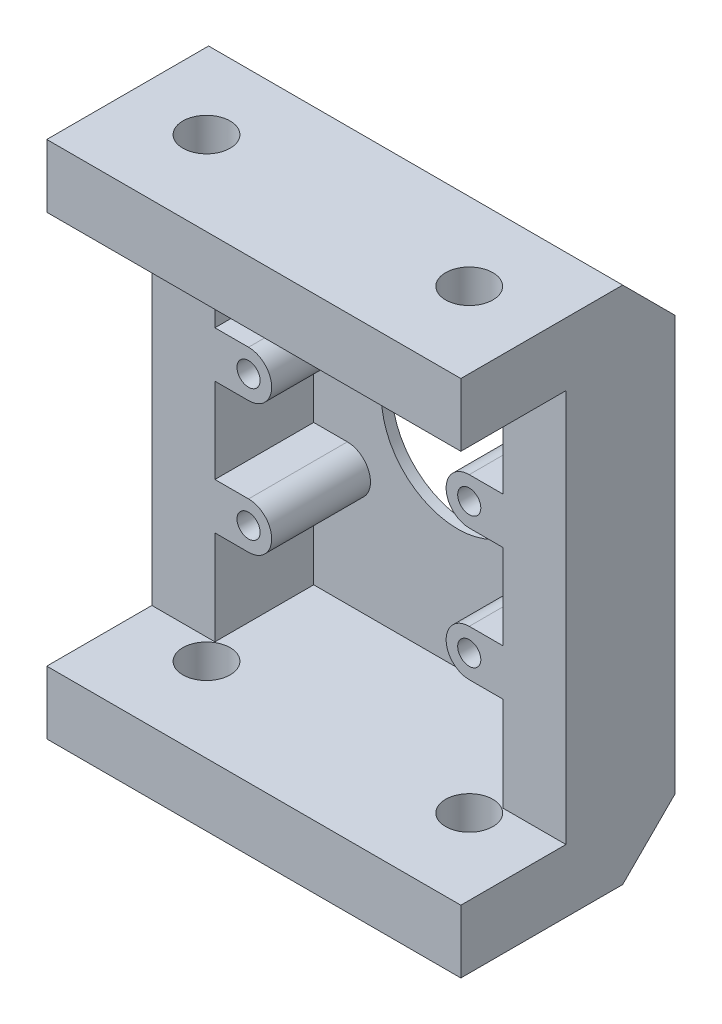
from build123d import *

# Parameters (mm, degrees)
SKETCH1_W                    = 39.4
SKETCH1_H                    = 49.4
BOSS_EXTRUDE1_DEPTH          = 1
SKETCH2_R                    = 7.25
CUT_EXTRUDE1_DEPTH           = 32.609808604
BOSS_EXTRUDE2_START          = -1
SKETCH3_R                    = 2.2
SKETCH3_R_2                  = 1
BOSS_EXTRUDE2_DEPTH          = 10.4
SKETCH4_W                    = 39.4
SKETCH4_H                    = 49.4
SKETCH4_W_2                  = 27.4
SKETCH4_H_2                  = 37.4
BOSS_EXTRUDE4_DEPTH          = 9.4
SKETCH5_W                    = 39.4
SKETCH5_H                    = 6
BOSS_EXTRUDE5_DEPTH          = 10
SKETCH6_R                    = 1.65
CUT_EXTRUDE3_DEPTH           = 57.961478211
SKETCH7_R                    = 2.25
CUT_EXTRUDE4_DEPTH           = 57.961478211
BOSS_EXTRUDE6_START          = -9.4
BOSS_EXTRUDE6_DEPTH          = 9.4
SKETCH9_R                    = 1.1
CUT_EXTRUDE5_DEPTH           = 8
CUT_EXTRUDE5_DRAFT           = -2
CUT_EXTRUDE5_PROFILE_2_DEPTH = 8
CUT_EXTRUDE5_PROFILE_2_DRAFT = -2
CUT_EXTRUDE5_PROFILE_3_DEPTH = 8
CUT_EXTRUDE5_PROFILE_3_DRAFT = -2
CUT_EXTRUDE5_PROFILE_4_DEPTH = 8
CUT_EXTRUDE5_PROFILE_4_DRAFT = -2
CHAMFER1_SIZE                = 5


with BuildPart() as part:
    # Sketch1 → Boss-Extrude1 (new body)
    with BuildSketch(Plane.XY):
        Rectangle(SKETCH1_W, SKETCH1_H)
    extrude(amount=BOSS_EXTRUDE1_DEPTH)

    # Sketch2 → Cut-Extrude1 (cut, through all)
    with BuildSketch(Plane.XY.offset(1)):
        Circle(SKETCH2_R)
    extrude(amount=-CUT_EXTRUDE1_DEPTH, mode=Mode.SUBTRACT)

    # Sketch3 → Boss-Extrude2 (add)
    # profile 1 of 4: a face of its own
    with BuildSketch(Plane.XY.offset(1).offset(BOSS_EXTRUDE2_START)):
        with Locations(Location((-10.5, 4.98, 0), (0, 0, 180))):
            Circle(SKETCH3_R)
        with Locations(Location((-10.5, 4.98, 0), (0, 0, 180))):
            Circle(SKETCH3_R_2, mode=Mode.SUBTRACT)
    # profile 2 of 4: a face of its own
    with BuildSketch(Plane.XY.offset(1).offset(BOSS_EXTRUDE2_START)):
        with Locations(Location((-10.5, -7.52, 0), (0, 0, 180))):
            Circle(SKETCH3_R)
        with Locations(Location((-10.5, -7.52, 0), (0, 0, 180))):
            Circle(SKETCH3_R_2, mode=Mode.SUBTRACT)
    # profile 3 of 4: a face of its own
    with BuildSketch(Plane.XY.offset(1).offset(BOSS_EXTRUDE2_START)):
        with Locations(Location((10.5, -7.52, 0), (0, 0, 180))):
            Circle(SKETCH3_R)
        with Locations(Location((10.5, -7.52, 0), (0, 0, 180))):
            Circle(SKETCH3_R_2, mode=Mode.SUBTRACT)
    # profile 4 of 4: a face of its own
    with BuildSketch(Plane.XY.offset(1).offset(BOSS_EXTRUDE2_START)):
        with Locations(Location((10.5, 4.98, 0), (0, 0, 180))):
            Circle(SKETCH3_R)
        with Locations(Location((10.5, 4.98, 0), (0, 0, 180))):
            Circle(SKETCH3_R_2, mode=Mode.SUBTRACT)
    extrude(amount=BOSS_EXTRUDE2_DEPTH)

    # Sketch4 → Boss-Extrude4 (add)
    with BuildSketch(Plane.XY.offset(1)):
        Rectangle(SKETCH4_W, SKETCH4_H)
        Rectangle(SKETCH4_W_2, SKETCH4_H_2, mode=Mode.SUBTRACT)
    extrude(amount=BOSS_EXTRUDE4_DEPTH)

    # Sketch5 → Boss-Extrude5 (add)
    with BuildSketch(Plane.XY.offset(10.4)):
        with Locations((0, 21.7)):
            Rectangle(SKETCH5_W, SKETCH5_H)
        with Locations((0, -21.7)):
            Rectangle(SKETCH5_W, SKETCH5_H)
    extrude(amount=BOSS_EXTRUDE5_DEPTH)

    # Sketch6 → Cut-Extrude3 (cut, through all)
    with BuildSketch(Plane(origin=(0, 24.7, 0), x_dir=(1, 0, 0), z_dir=(0, 1, 0))):
        with Locations(Location((-12.5, -12.4, 0), (0, 0, 180))):
            Circle(SKETCH6_R)
        with Locations(Location((12.5, -12.4, 0), (0, 0, 180))):
            Circle(SKETCH6_R)
    extrude(amount=-CUT_EXTRUDE3_DEPTH, mode=Mode.SUBTRACT)

    # Sketch7 → Cut-Extrude4 (cut, through all)
    with BuildSketch(Plane(origin=(0, 24.7, 0), x_dir=(1, 0, 0), z_dir=(0, 1, 0))):
        with Locations(Location((12.5, -12.4, 0), (0, 0, 180))):
            Circle(SKETCH7_R)
        with Locations(Location((-12.5, -12.4, 0), (0, 0, 180))):
            Circle(SKETCH7_R)
    extrude(amount=-CUT_EXTRUDE4_DEPTH, mode=Mode.SUBTRACT)

    # Sketch8 → Boss-Extrude6 (add)
    with BuildSketch(Plane.XY.offset(10.4).offset(BOSS_EXTRUDE6_START)):
        with BuildLine():
            Line((-10.5, 7.18), (-13.7, 7.18))
            Line((-13.7, 7.18), (-13.7, 2.78))
            Line((-13.7, 2.78), (-10.5, 2.78))
            ThreePointArc((-10.5, 2.78), (-8.3, 4.98), (-10.5, 7.18))
        make_face()
        with BuildLine():
            Line((-10.5, -5.32), (-13.7, -5.32))
            Line((-13.7, -5.32), (-13.7, -9.72))
            Line((-13.7, -9.72), (-10.5, -9.72))
            ThreePointArc((-10.5, -9.72), (-8.3, -7.52), (-10.5, -5.32))
        make_face()
        with BuildLine():
            Line((10.5, 7.18), (13.7, 7.18))
            Line((13.7, 7.18), (13.7, 2.78))
            Line((13.7, 2.78), (10.5, 2.78))
            ThreePointArc((10.5, 2.78), (8.3, 4.98), (10.5, 7.18))
        make_face()
        with BuildLine():
            Line((10.5, -5.32), (13.7, -5.32))
            Line((13.7, -5.32), (13.7, -9.72))
            Line((13.7, -9.72), (10.5, -9.72))
            ThreePointArc((10.5, -9.72), (8.3, -7.52), (10.5, -5.32))
        make_face()
    extrude(amount=BOSS_EXTRUDE6_DEPTH)


with BuildPart() as cut_extrude5_tool:
    # Sketch9 → Cut-Extrude5 (with draft: the straight prism first)
    with BuildSketch(Plane.XY.offset(10.4)):
        with Locations((-10.5, 4.98)):
            Circle(SKETCH9_R)
    extrude(amount=-CUT_EXTRUDE5_DEPTH)
    # Cut-Extrude5: the draft: its side faces are tilted about the plane it starts from
    cut_extrude5_sides = [cut_extrude5_tool.faces().sort_by_distance(p)[0] for p in [
        (-11.6, 4.98, 6.4),
    ]]
    draft(cut_extrude5_sides, Plane.XY.offset(10.4), CUT_EXTRUDE5_DRAFT)


with BuildPart() as part_1:
    add(part.part)

    # Cut-Extrude5: cut by cut_extrude5_tool
    add(cut_extrude5_tool.part, mode=Mode.SUBTRACT)


with BuildPart() as cut_extrude5_profile_2_tool:
    # Sketch9 → Cut-Extrude5 profile 2 (with draft: the straight prism first)
    with BuildSketch(Plane.XY.offset(10.4)):
        with Locations((10.5, 4.98)):
            Circle(SKETCH9_R)
    extrude(amount=-CUT_EXTRUDE5_PROFILE_2_DEPTH)
    # Cut-Extrude5 profile 2: the draft: its side faces are tilted about the plane it starts from
    cut_extrude5_profile_2_sides = [cut_extrude5_profile_2_tool.faces().sort_by_distance(p)[0] for p in [
        (9.4, 4.98, 6.4),
    ]]
    draft(cut_extrude5_profile_2_sides, Plane.XY.offset(10.4), CUT_EXTRUDE5_PROFILE_2_DRAFT)


with BuildPart() as part_2:
    add(part_1.part)

    # Cut-Extrude5 profile 2: cut by cut_extrude5_profile_2_tool
    add(cut_extrude5_profile_2_tool.part, mode=Mode.SUBTRACT)


with BuildPart() as cut_extrude5_profile_3_tool:
    # Sketch9 → Cut-Extrude5 profile 3 (with draft: the straight prism first)
    with BuildSketch(Plane.XY.offset(10.4)):
        with Locations((10.5, -7.52)):
            Circle(SKETCH9_R)
    extrude(amount=-CUT_EXTRUDE5_PROFILE_3_DEPTH)
    # Cut-Extrude5 profile 3: the draft: its side faces are tilted about the plane it starts from
    cut_extrude5_profile_3_sides = [cut_extrude5_profile_3_tool.faces().sort_by_distance(p)[0] for p in [
        (9.4, -7.52, 6.4),
    ]]
    draft(cut_extrude5_profile_3_sides, Plane.XY.offset(10.4), CUT_EXTRUDE5_PROFILE_3_DRAFT)


with BuildPart() as part_3:
    add(part_2.part)

    # Cut-Extrude5 profile 3: cut by cut_extrude5_profile_3_tool
    add(cut_extrude5_profile_3_tool.part, mode=Mode.SUBTRACT)


with BuildPart() as cut_extrude5_profile_4_tool:
    # Sketch9 → Cut-Extrude5 profile 4 (with draft: the straight prism first)
    with BuildSketch(Plane.XY.offset(10.4)):
        with Locations((-10.5, -7.52)):
            Circle(SKETCH9_R)
    extrude(amount=-CUT_EXTRUDE5_PROFILE_4_DEPTH)
    # Cut-Extrude5 profile 4: the draft: its side faces are tilted about the plane it starts from
    cut_extrude5_profile_4_sides = [cut_extrude5_profile_4_tool.faces().sort_by_distance(p)[0] for p in [
        (-11.6, -7.52, 6.4),
    ]]
    draft(cut_extrude5_profile_4_sides, Plane.XY.offset(10.4), CUT_EXTRUDE5_PROFILE_4_DRAFT)


with BuildPart() as part_4:
    add(part_3.part)

    # Cut-Extrude5 profile 4: cut by cut_extrude5_profile_4_tool
    add(cut_extrude5_profile_4_tool.part, mode=Mode.SUBTRACT)

    # Chamfer1
    chamfer1_edges = [part_4.edges().sort_by_distance(p)[0] for p in [
        (0, 24.7, 0),
        (0, -24.7, 0),
    ]]
    chamfer(chamfer1_edges, length=CHAMFER1_SIZE)


solid = part_4.part
